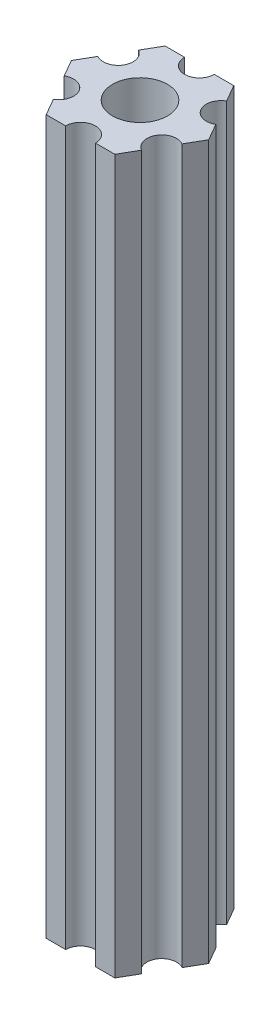
from build123d import *

# Parameters (mm, degrees)
SKETCH1_R           = 2.9337
BOSS_EXTRUDE1_DEPTH = 76.2


with BuildPart() as part:
    # Sketch1 → Boss-Extrude1 (new body)
    with BuildSketch(Plane(origin=(0, 0, 0), x_dir=(1, 0, 0), z_dir=(0, 1, 0))):
        with BuildLine():
            Line((-4.70551159, -4.549815043), (-3.666174521, -6.349999904))
            Line((-3.666174521, -6.349999904), (-1.587501539, -6.349999904))
            ThreePointArc((-1.587501539, -6.349999904), (-3.85e-07, -4.76249875), (1.587501539, -6.349999904))
            Line((1.587501539, -6.349999904), (3.666173825, -6.349999904))
            Line((3.666173825, -6.349999904), (4.705510929, -4.549815232))
            ThreePointArc((4.705510929, -4.549815232), (4.124445601, -2.381249904), (6.293010929, -1.800184575))
            Line((6.293010929, -1.800184575), (7.332348034, 9.6e-08))
            Line((7.332348034, 9.6e-08), (6.293011178, 1.800184715))
            ThreePointArc((6.293011178, 1.800184715), (4.124445902, 2.381250241), (4.705511428, 4.549815516))
            Line((4.705511428, 4.549815516), (3.666174521, 6.350000222))
            Line((3.666174521, 6.350000222), (1.587498461, 6.350000222))
            ThreePointArc((1.587498461, 6.350000222), (3.85e-07, 4.762502146), (-1.587498461, 6.350000222))
            Line((-1.587498461, 6.350000222), (-3.666173825, 6.350000222))
            Line((-3.666173825, 6.350000222), (-4.705511038, 4.549815614))
            ThreePointArc((-4.705511038, 4.549815614), (-4.124445841, 2.38125025), (-6.293011205, 1.800185053))
            Line((-6.293011205, 1.800185053), (-7.332348419, 4.44e-07))
            Line((-7.332348419, 4.44e-07), (-6.293011423, -1.80018429))
            ThreePointArc((-6.293011423, -1.80018429), (-4.12444613, -2.38124975), (-4.70551159, -4.549815043))
        make_face()
        with Locations(Location((0, 0, 0), (0, 0, 90))):
            Circle(SKETCH1_R, mode=Mode.SUBTRACT)
    extrude(amount=BOSS_EXTRUDE1_DEPTH)


solid = part.part
